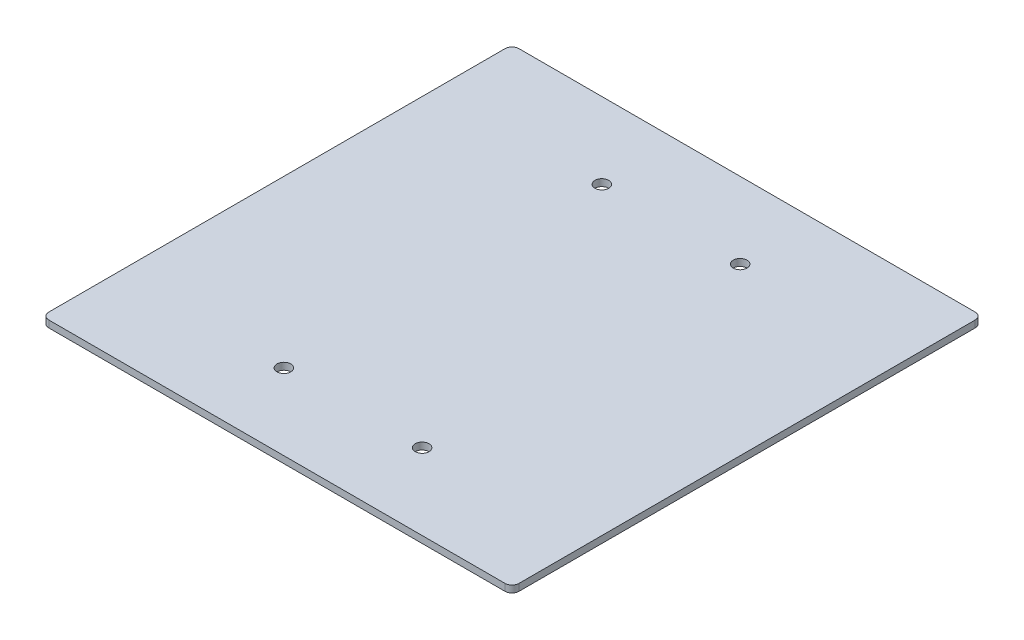
from build123d import *

# Parameters (mm, degrees)
SKETCH2_W           = 215.9
SKETCH2_H           = 215.9
BOSS_EXTRUDE1_DEPTH = 3.175
FILLET1_R           = 3.175
SKETCH4_R           = 3.175
CUT_EXTRUDE1_DEPTH  = 306.345215494


with BuildPart() as part:
    # Sketch2 → Boss-Extrude1 (new body)
    with BuildSketch(Plane(origin=(0, 0, 0), x_dir=(1, 0, 0), z_dir=(0, 1, 0))):
        with Locations((107.95, 107.95)):
            Rectangle(SKETCH2_W, SKETCH2_H)
    extrude(amount=BOSS_EXTRUDE1_DEPTH)

    # Fillet1
    fillet1_edges = [part.edges().sort_by_distance(p)[0] for p in [
        (0, 1.5875, -215.9),
        (215.9, 1.5875, -215.9),
        (215.9, 1.5875, 0),
        (0, 1.5875, 0),
    ]]
    fillet(fillet1_edges, radius=FILLET1_R)

    # Sketch4 → Cut-Extrude1 (cut, through all)
    with BuildSketch(Plane(origin=(0, 3.175, 0), x_dir=(1, 0, 0), z_dir=(0, 1, 0))):
        with Locations(Location((76.2, 180.975, 0), (0, 0, 270))):
            Circle(SKETCH4_R)
        with Locations(Location((139.7, 180.975, 0), (0, 0, 270))):
            Circle(SKETCH4_R)
        with Locations(Location((139.7, 34.925, 0), (0, 0, 270))):
            Circle(SKETCH4_R)
        with Locations(Location((76.2, 34.925, 0), (0, 0, 270))):
            Circle(SKETCH4_R)
    extrude(amount=-CUT_EXTRUDE1_DEPTH, mode=Mode.SUBTRACT)


solid = part.part
